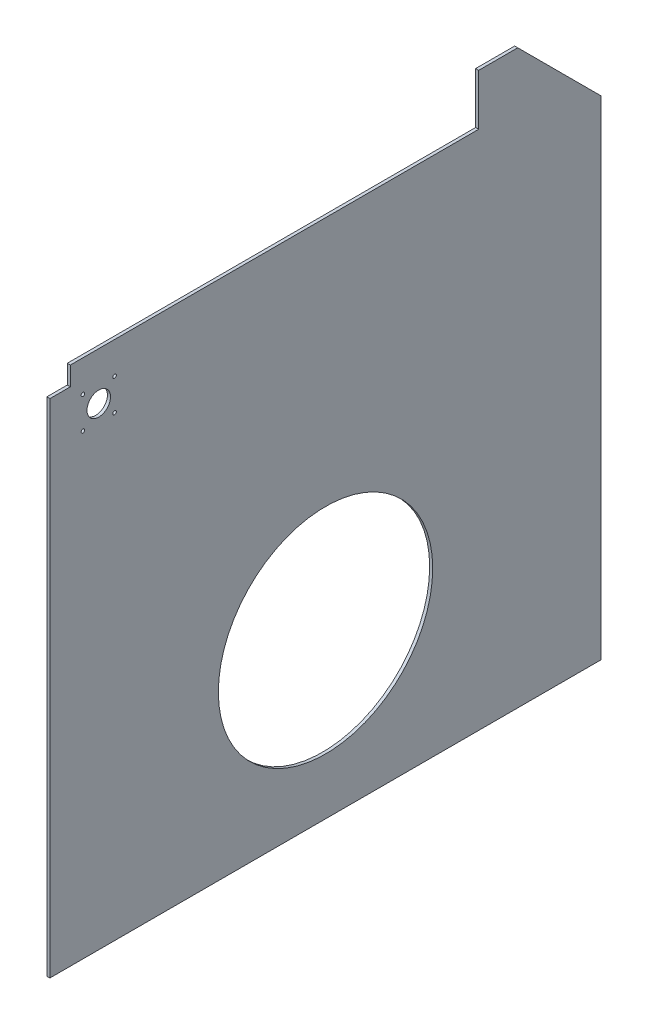
from build123d import *

# Parameters (mm, degrees)
BOSS_EXTRUDE1_DEPTH = 3
SKETCH3_R           = 105
CUT_EXTRUDE1_DEPTH  = 3
SKETCH4_R           = 1.75
SKETCH4_R_2         = 11.5
CUT_EXTRUDE2_DEPTH  = 15


with BuildPart() as part:
    # Sketch1 → Boss-Extrude1 (new body)
    with BuildSketch(Plane(origin=(0, 0, 0), x_dir=(0, 0, -1), z_dir=(1, 0, 0))):
        Polygon((540, 475.629480553), (540, 478.284271247), (458.284271247, 560), (420, 560), (420, 510), (20, 510), (20, 491.519731167), (0, 491.519731167), (0, 475.629480553), (0, 0), (540, 0), align=None)
    extrude(amount=BOSS_EXTRUDE1_DEPTH)

    # Sketch3 → Cut-Extrude1 (cut)
    with BuildSketch(Plane.ZY):
        with Locations((-270, 160)):
            Circle(SKETCH3_R)
    extrude(amount=-CUT_EXTRUDE1_DEPTH, mode=Mode.SUBTRACT)

    # Sketch4 → Cut-Extrude2 (cut)
    with BuildSketch(Plane(origin=(3, 0, 0), x_dir=(0, 0, -1), z_dir=(1, 0, 0))):
        with Locations((32.367626301, 478.88695563)):
            Circle(SKETCH4_R)
        with Locations((32.367626301, 447.88695563)):
            Circle(SKETCH4_R)
        with Locations((63.367626301, 447.88695563)):
            Circle(SKETCH4_R)
        with Locations((63.367626301, 478.88695563)):
            Circle(SKETCH4_R)
        with Locations((47.867626301, 463.38695563)):
            Circle(SKETCH4_R_2)
    extrude(amount=-CUT_EXTRUDE2_DEPTH, mode=Mode.SUBTRACT)


solid = part.part
